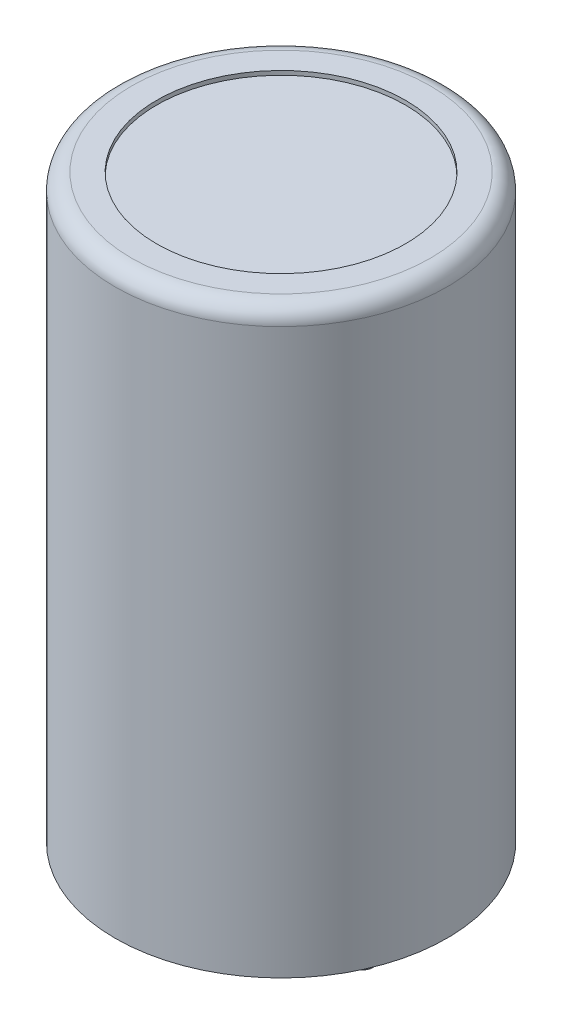
from build123d import *

# Parameters (mm, degrees)
SKETCH1_R           = 5.08
BOSS_EXTRUDE1_DEPTH = 17.78
SKETCH2_R           = 0.3175
BOSS_EXTRUDE2_DEPTH = 1.905
SKETCH3_R           = 3.81
CUT_EXTRUDE1_DEPTH  = 0.127
FILLET1_R           = 0.508


with BuildPart() as part:
    # Sketch1 → Boss-Extrude1 (new body)
    with BuildSketch(Plane(origin=(0, 0, 0), x_dir=(1, 0, 0), z_dir=(0, 1, 0))):
        with Locations(Location((0, 0, 0), (0, 0, 270))):
            Circle(SKETCH1_R)
    extrude(amount=BOSS_EXTRUDE1_DEPTH)

    # Sketch2 → Boss-Extrude2 (add)
    with BuildSketch(Plane.XZ):
        with Locations(Location((-2.5, 0, 0), (0, 0, 90))):
            Circle(SKETCH2_R)
        with Locations(Location((2.5, 0, 0), (0, 0, 90))):
            Circle(SKETCH2_R)
    extrude(amount=BOSS_EXTRUDE2_DEPTH)

    # Sketch3 → Cut-Extrude1 (cut)
    with BuildSketch(Plane(origin=(0, 17.78, 0), x_dir=(1, 0, 0), z_dir=(0, 1, 0))):
        with Locations(Location((0, 0, 0), (0, 0, 270))):
            Circle(SKETCH3_R)
    extrude(amount=-CUT_EXTRUDE1_DEPTH, mode=Mode.SUBTRACT)

    # Fillet1
    fillet1_edges = [part.edges().sort_by_distance(p)[0] for p in [
        (0, 17.78, -5.08),
    ]]
    fillet(fillet1_edges, radius=FILLET1_R)


solid = part.part
